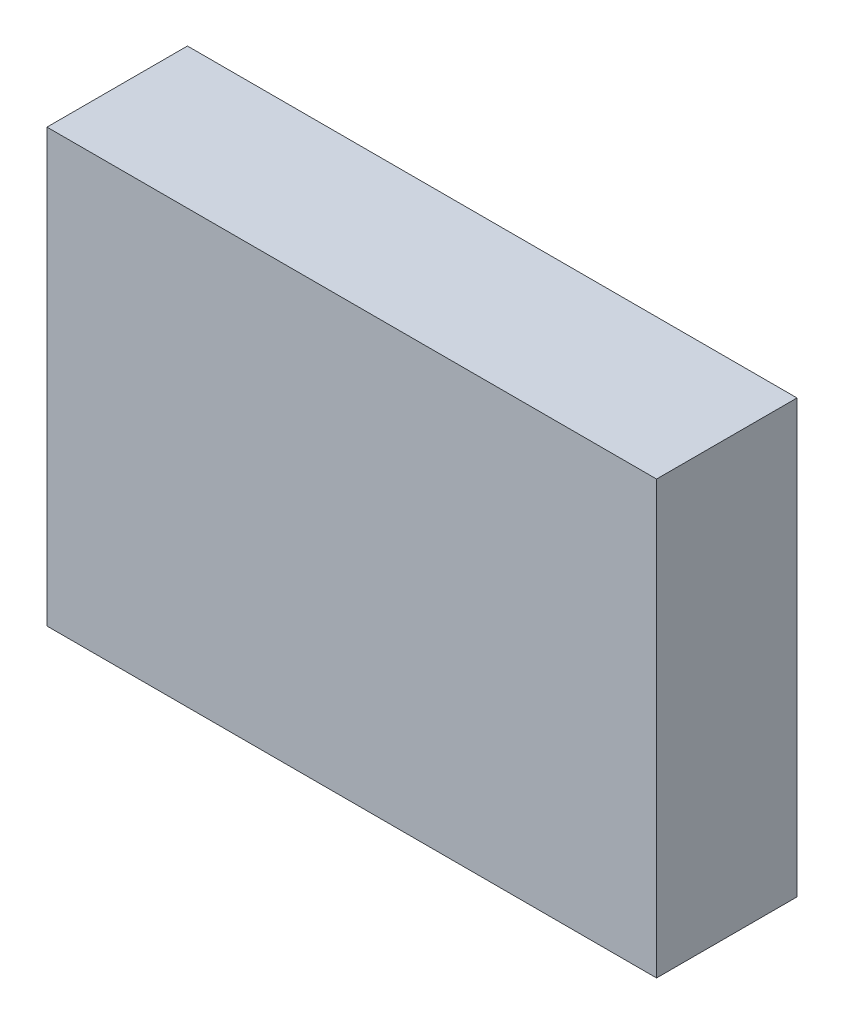
from build123d import *

# Parameters (mm, degrees)
SKETCH1_W           = 110.237040332
SKETCH1_H           = 78.14500721
BOSS_EXTRUDE1_DEPTH = 25.4


with BuildPart() as part:
    # Sketch1 → Boss-Extrude1 (new body)
    with BuildSketch(Plane.XY):
        Rectangle(SKETCH1_W, SKETCH1_H)
    extrude(amount=-BOSS_EXTRUDE1_DEPTH)


solid = part.part
